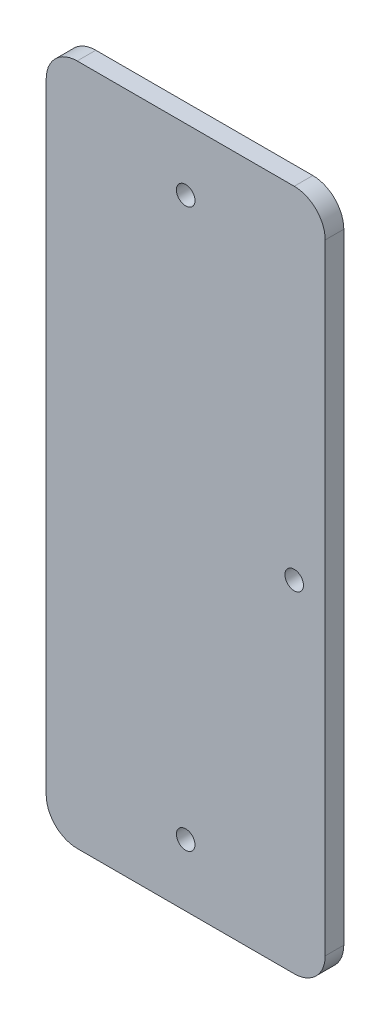
from build123d import *

# Parameters (mm, degrees)
SKETCH1_R           = 1.5
BOSS_EXTRUDE1_DEPTH = 3
SKETCH4_R           = 1.5
CUT_EXTRUDE1_DEPTH  = 60.5


with BuildPart() as part:
    # Sketch1 → Boss-Extrude1 (new body)
    with BuildSketch(Plane.XY):
        with BuildLine():
            Line((-17.5, 55), (17.5, 55))
            ThreePointArc((17.5, 55), (21.035533906, 53.535533906), (22.5, 50))
            Line((22.5, 50), (22.5, -50))
            ThreePointArc((22.5, -50), (21.035533906, -53.535533906), (17.5, -55))
            Line((17.5, -55), (-17.5, -55))
            ThreePointArc((-17.5, -55), (-21.035533906, -53.535533906), (-22.5, -50))
            Line((-22.5, -50), (-22.5, 50))
            ThreePointArc((-22.5, 50), (-21.035533906, 53.535533906), (-17.5, 55))
        make_face()
        with Locations((17.5, 0)):
            Circle(SKETCH1_R, mode=Mode.SUBTRACT)
    extrude(amount=BOSS_EXTRUDE1_DEPTH)

    # Sketch4 → Cut-Extrude1 (cut, through all)
    with BuildSketch(Plane.XY.offset(3)):
        with Locations((0, 45)):
            Circle(SKETCH4_R)
        with Locations((0, -45)):
            Circle(SKETCH4_R)
    extrude(amount=-CUT_EXTRUDE1_DEPTH, mode=Mode.SUBTRACT)


solid = part.part
